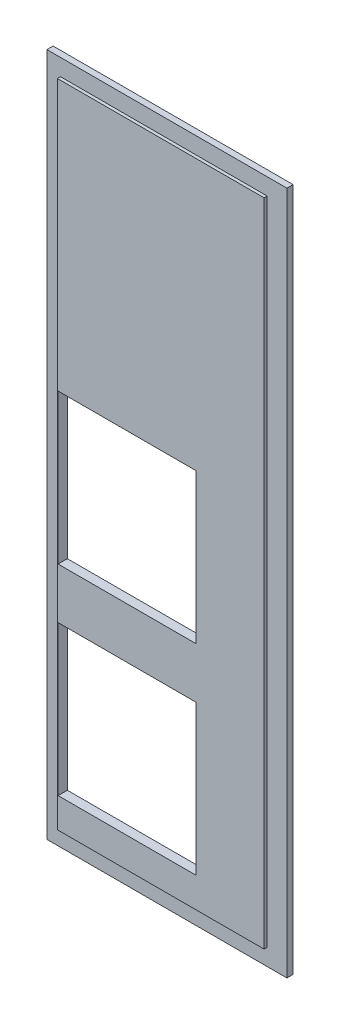
from build123d import *

# Parameters (mm, degrees)
SKETCH_1_W          = 110.7
SKETCH_1_H          = 38.85
EXTRUDE_1_DEPTH     = 1
SKETCH_2_W          = 33.45
SKETCH_2_H          = 105.3
EXTRUDE_2_DEPTH     = 0.5
SKETCH_3_W          = 22.339400882
SKETCH_3_H          = 24.25
CUT_EXTRUDE_1_DEPTH = 2


with BuildPart() as part:
    # Эскиз1 → Бобышка-Вытянуть1 (new body)
    with BuildSketch(Plane(origin=(0.5, 0, 0), x_dir=(0, -1, 0), z_dir=(0, 0, 1))):
        with Locations((-45.5, 22.825)):
            Rectangle(SKETCH_1_W, SKETCH_1_H)
    extrude(amount=-EXTRUDE_1_DEPTH)

    # Эскиз2 → Бобышка-Вытянуть2 (add)
    with BuildSketch(Plane.XY):
        with Locations((22.825, 45.5)):
            Rectangle(SKETCH_2_W, SKETCH_2_H)
    extrude(amount=EXTRUDE_2_DEPTH)

    # Эскиз3 → Вырез-Вытянуть1 (cut)
    with BuildSketch(Plane.XY.offset(0.5)):
        with Locations((17.385892666, 42.275)):
            Rectangle(SKETCH_3_W, SKETCH_3_H)
        with Locations((17.385892666, 9.819443695)):
            Rectangle(SKETCH_3_W, SKETCH_3_H)
    extrude(amount=-CUT_EXTRUDE_1_DEPTH, mode=Mode.SUBTRACT)


solid = part.part
